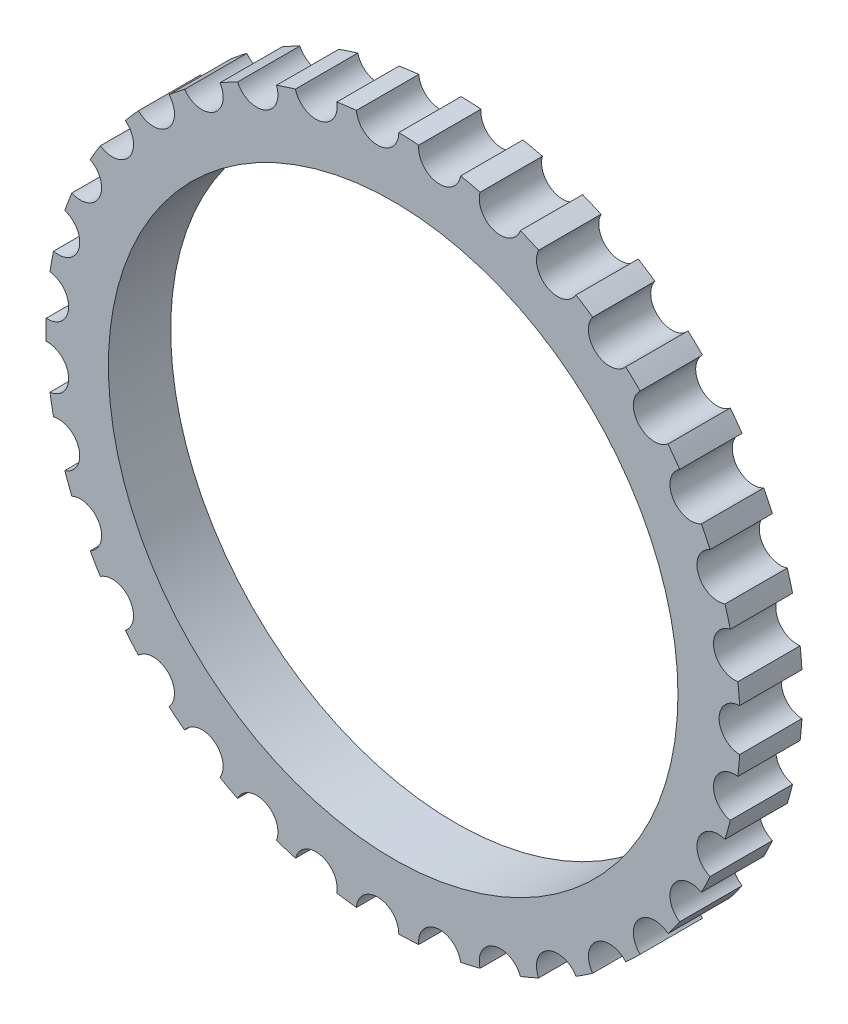
from build123d import *

# Parameters (mm, degrees)
SKETCH1_R           = 27.852115
SKETCH1_R_2         = 22.852115
BOSS_EXTRUDE1_DEPTH = 5
SKETCH3_R           = 1.7
CUT_EXTRUDE1_DEPTH  = 8


with BuildPart() as part:
    # Sketch1 → Boss-Extrude1 (new body)
    with BuildSketch(Plane.XY):
        Circle(SKETCH1_R)
        Circle(SKETCH1_R_2, mode=Mode.SUBTRACT)
    extrude(amount=BOSS_EXTRUDE1_DEPTH)

    # Sketch3 → Cut-Extrude1 (cut, symmetric)
    with BuildSketch(Plane.XY.offset(2.5)):
        with Locations((27.852115, 0)):
            Circle(SKETCH3_R)
        with Locations((27.404520054, -4.973187168)):
            Circle(SKETCH3_R)
        with Locations((26.076121284, -9.786532008)):
            Circle(SKETCH3_R)
        with Locations((23.909614521, -14.285329658)):
            Circle(SKETCH3_R)
        with Locations((20.974633074, -18.324985058)):
            Circle(SKETCH3_R)
        with Locations((17.365509663, -21.77566036)):
            Circle(SKETCH3_R)
        with Locations((13.198244482, -24.526448022)):
            Circle(SKETCH3_R)
        with Locations((8.606776864, -26.488935463)):
            Circle(SKETCH3_R)
        with Locations((3.738680356, -27.600046724)):
            Circle(SKETCH3_R)
        with Locations((-1.249580414, -27.824069774)):
            Circle(SKETCH3_R)
        with Locations((-6.197678642, -27.153804327)):
            Circle(SKETCH3_R)
        with Locations((-10.94657838, -25.610793267)):
            Circle(SKETCH3_R)
        with Locations((-15.343646081, -23.244630239)):
            Circle(SKETCH3_R)
        with Locations((-19.247556372, -20.131365669)):
            Circle(SKETCH3_R)
        with Locations((-22.532834364, -16.371062442)):
            Circle(SKETCH3_R)
        with Locations((-25.09388852, -12.084579799)):
            Circle(SKETCH3_R)
        with Locations((-26.848404452, -7.409688817)):
            Circle(SKETCH3_R)
        with Locations((-27.739990573, -2.49664434)):
            Circle(SKETCH3_R)
        with Locations((-27.739990573, 2.49664434)):
            Circle(SKETCH3_R)
        with Locations((-26.848404452, 7.409688817)):
            Circle(SKETCH3_R)
        with Locations((-25.09388852, 12.084579799)):
            Circle(SKETCH3_R)
        with Locations((-22.532834364, 16.371062442)):
            Circle(SKETCH3_R)
        with Locations((-19.247556372, 20.131365669)):
            Circle(SKETCH3_R)
        with Locations((-15.343646081, 23.244630239)):
            Circle(SKETCH3_R)
        with Locations((-10.94657838, 25.610793267)):
            Circle(SKETCH3_R)
        with Locations((-6.197678642, 27.153804327)):
            Circle(SKETCH3_R)
        with Locations((-1.249580414, 27.824069774)):
            Circle(SKETCH3_R)
        with Locations((3.738680356, 27.600046724)):
            Circle(SKETCH3_R)
        with Locations((8.606776864, 26.488935463)):
            Circle(SKETCH3_R)
        with Locations((13.198244482, 24.526448022)):
            Circle(SKETCH3_R)
        with Locations((17.365509663, 21.77566036)):
            Circle(SKETCH3_R)
        with Locations((20.974633074, 18.324985058)):
            Circle(SKETCH3_R)
        with Locations((23.909614521, 14.285329658)):
            Circle(SKETCH3_R)
        with Locations((26.076121284, 9.786532008)):
            Circle(SKETCH3_R)
        with Locations((27.404520054, 4.973187168)):
            Circle(SKETCH3_R)
    extrude(amount=CUT_EXTRUDE1_DEPTH, both=True, mode=Mode.SUBTRACT)


solid = part.part
